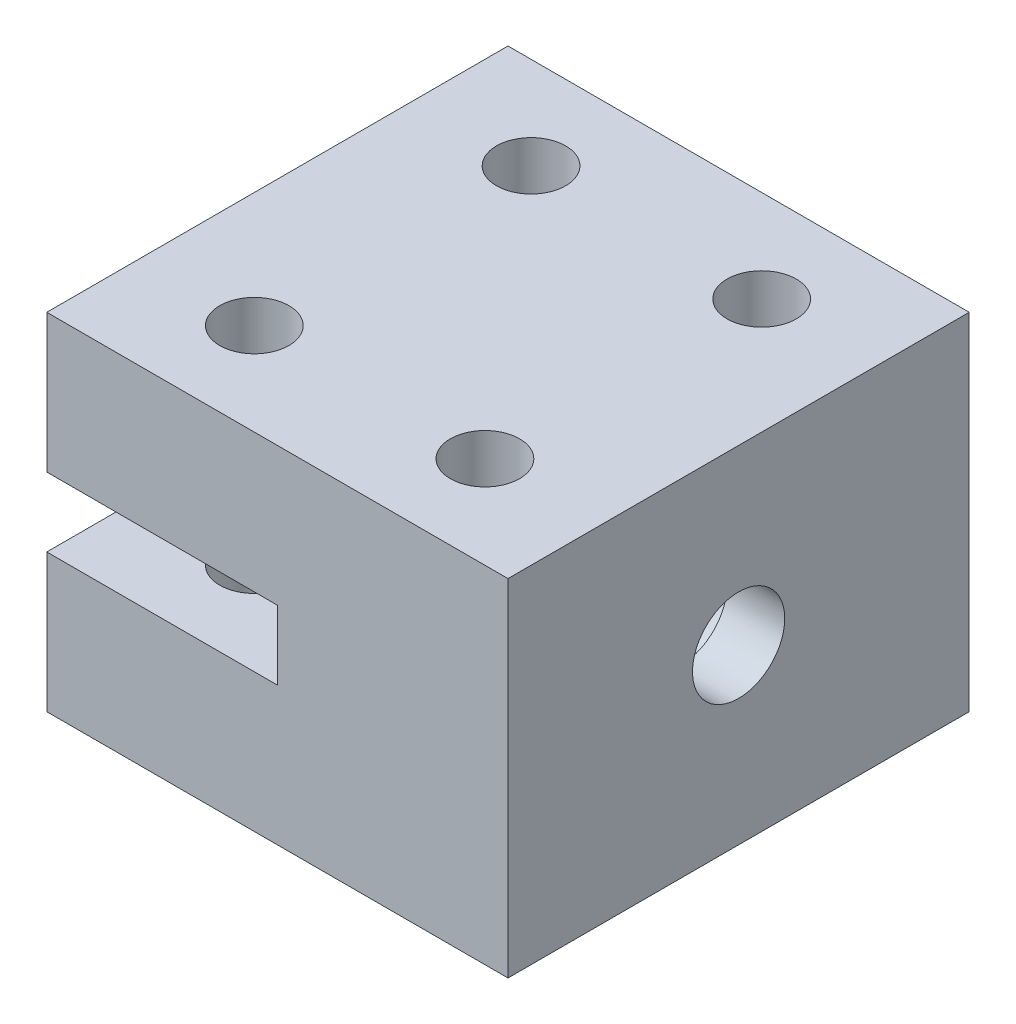
from build123d import *

# Parameters (mm, degrees)
SKETCH1_W            = 20
SKETCH1_H            = 20
BOSS_EXTRUDE1_DEPTH  = 7.5
SKETCH1_3_W          = 20
SKETCH1_3_H          = 20
CUT_EXTRUDE2_DEPTH   = 1.5
SKETCH3_W            = 10
SKETCH3_H            = 20
BOSS_EXTRUDE2_DEPTH  = 1.5
SKETCH4_R            = 2
CUT_EXTRUDE3_DEPTH   = 5
MOUNTHOLE_DEPTH      = 17.007810594
MOUNTHOLE_DEPTH_BACK = 17.007810594
SKETCH5_R            = 1.5
SKETCH6_R            = 3.5
BEARINGHOLE_DEPTH    = 2.5


with BuildPart() as part:
    # Sketch1 → Boss-Extrude1 (new, symmetric)
    with BuildSketch(Plane(origin=(0, 0, 0), x_dir=(1, 0, 0), z_dir=(0, 1, 0))):
        Rectangle(SKETCH1_W, SKETCH1_H)
    extrude(amount=BOSS_EXTRUDE1_DEPTH, both=True)

    # Sketch1<3> → Cut-Extrude2 (cut, symmetric)
    with BuildSketch(Plane(origin=(0, 0, 0), x_dir=(1, 0, 0), z_dir=(0, 1, 0))):
        Rectangle(SKETCH1_3_W, SKETCH1_3_H)
    extrude(amount=CUT_EXTRUDE2_DEPTH, both=True, mode=Mode.SUBTRACT)


with BuildPart() as cut_extrude2_piece_1:
    # of the separate pieces the step leaves, piece 1, a body of its own (cut_extrude2_pieces)
    add(part.part.solids().sort_by_distance((-10, -7.5, -10))[0])



with BuildPart() as cut_extrude2_piece_2:
    # of the separate pieces the step leaves, piece 2, a body of its own (cut_extrude2_pieces)
    add(part.part.solids().sort_by_distance((-10, 1.5, -10))[0])


with BuildPart() as cut_extrude2_piece_1_1:
    add(cut_extrude2_piece_1.part)

    add(cut_extrude2_piece_2.part)  # Boss-Extrude2 merges Cut-Extrude2 piece 2
    # Sketch3 → Boss-Extrude2 (add, symmetric)
    with BuildSketch(Plane(origin=(0, 0, 0), x_dir=(1, 0, 0), z_dir=(0, 1, 0))):
        with Locations((5, 0)):
            Rectangle(SKETCH3_W, SKETCH3_H)
    extrude(amount=BOSS_EXTRUDE2_DEPTH, both=True)

    # Sketch4 → Cut-Extrude3 (cut)
    with BuildSketch(Plane(origin=(10, 0, 0), x_dir=(0, 0, -1), z_dir=(1, 0, 0))):
        Circle(SKETCH4_R)
    extrude(amount=-CUT_EXTRUDE3_DEPTH, mode=Mode.SUBTRACT)

    # Sketch5 → mounthole (cut, two sides: drawn at the far end of the back side and taken through both)
    with BuildSketch(Plane(origin=(0, 0, 0), x_dir=(1, 0, 0), z_dir=(0, 1, 0)).offset(-MOUNTHOLE_DEPTH_BACK)):
        with Locations((-5, 6)):
            Circle(SKETCH5_R)
        with Locations((5, 6)):
            Circle(SKETCH5_R)
        with Locations((5, -6)):
            Circle(SKETCH5_R)
        with Locations((-5, -6)):
            Circle(SKETCH5_R)
    extrude(amount=MOUNTHOLE_DEPTH + MOUNTHOLE_DEPTH_BACK, mode=Mode.SUBTRACT)

    # Sketch6 → bearinghole (cut)
    with BuildSketch(Plane(origin=(5, 0, 0), x_dir=(0, 0, -1), z_dir=(1, 0, 0))):
        Circle(SKETCH6_R)
    extrude(amount=BEARINGHOLE_DEPTH, mode=Mode.SUBTRACT)


solid = cut_extrude2_piece_1_1.part
